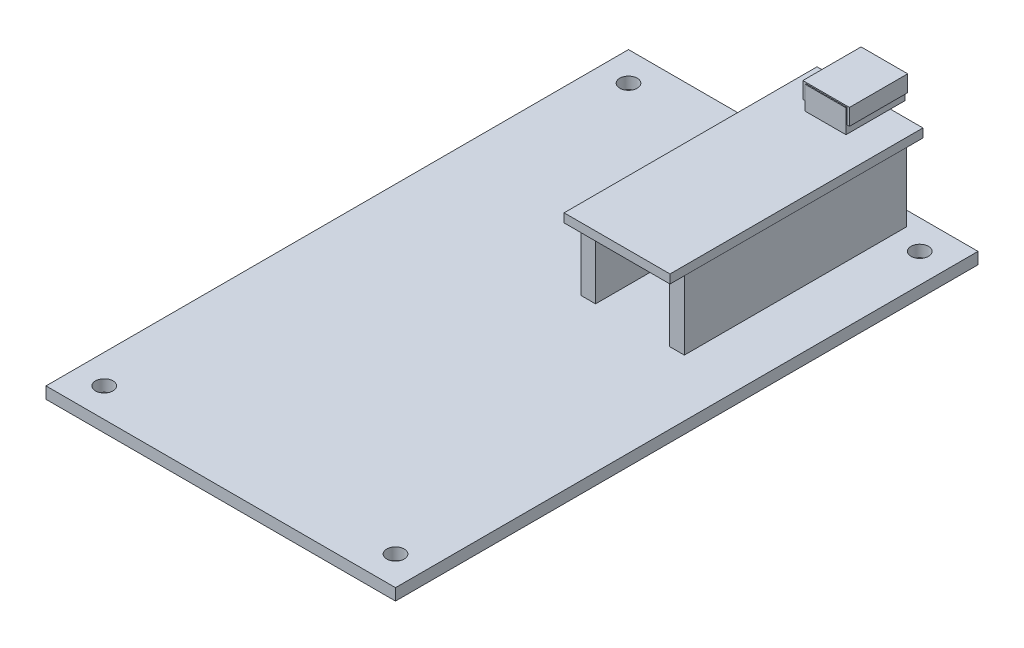
from build123d import *

# Parameters (mm, degrees)
CROQUIS1_W              = 60
CROQUIS1_H              = 100
CROQUIS1_R              = 1.5
SALIENTE_EXTRUIR1_DEPTH = 2
CROQUIS2_W              = 2.54
CROQUIS2_H              = 38.1
SALIENTE_EXTRUIR2_DEPTH = 12
CROQUIS3_W              = 18.18
CROQUIS3_H              = 43.42
SALIENTE_EXTRUIR3_DEPTH = 1.5
CROQUIS4_W              = 7
CROQUIS4_H              = 10.16
SALIENTE_EXTRUIR4_DEPTH = 4
SALIENTE_EXTRUIR5_DEPTH = 10


with BuildPart() as part:
    # Croquis1 → Saliente-Extruir1 (new body)
    with BuildSketch(Plane(origin=(0, 0, 0), x_dir=(1, 0, 0), z_dir=(0, 1, 0))):
        Rectangle(CROQUIS1_W, CROQUIS1_H)
        with Locations(Location((-25, 45, 0), (0, 0, 270))):
            Circle(CROQUIS1_R, mode=Mode.SUBTRACT)
        with Locations(Location((25, 45, 0), (0, 0, 90))):
            Circle(CROQUIS1_R, mode=Mode.SUBTRACT)
        with Locations(Location((25, -45, 0), (0, 0, 270))):
            Circle(CROQUIS1_R, mode=Mode.SUBTRACT)
        with Locations(Location((-25, -45, 0), (0, 0, 90))):
            Circle(CROQUIS1_R, mode=Mode.SUBTRACT)
    extrude(amount=SALIENTE_EXTRUIR1_DEPTH)

    # Croquis2 → Saliente-Extruir2 (add)
    with BuildSketch(Plane(origin=(0, 2, 0), x_dir=(1, 0, 0), z_dir=(0, 1, 0))):
        with Locations((3.711, 28.415)):
            Rectangle(CROQUIS2_W, CROQUIS2_H)
        with Locations((18.951, 28.415)):
            Rectangle(CROQUIS2_W, CROQUIS2_H)
    extrude(amount=SALIENTE_EXTRUIR2_DEPTH)


with BuildPart() as body_2:
    # Croquis3 → Saliente-Extruir3 (new body)
    with BuildSketch(Plane(origin=(0, 14, 0), x_dir=(1, 0, 0), z_dir=(0, 1, 0))):
        with Locations((11.331, 28.415)):
            Rectangle(CROQUIS3_W, CROQUIS3_H)
    extrude(amount=SALIENTE_EXTRUIR3_DEPTH)

    # Croquis4 → Saliente-Extruir4 (add)
    with BuildSketch(Plane(origin=(0, 15.5, 0), x_dir=(1, 0, 0), z_dir=(0, 1, 0))):
        with Locations((11.331, 47.585)):
            Rectangle(CROQUIS4_W, CROQUIS4_H)
    extrude(amount=SALIENTE_EXTRUIR4_DEPTH)

    # Croquis5 → Saliente-Extruir5 (add)
    with BuildSketch(Plane(origin=(0, 0, -52.665), x_dir=(-1, 0, 0), z_dir=(0, 0, -1))):
        Polygon((-15.26489693, 16.89), (-14.76489693, 16.89), (-14.76489693, 15.5), (-7.76489693, 15.5), (-7.76489693, 16.89), (-7.26489693, 16.89), (-7.26489693, 19.7), (-15.26489693, 19.7), align=None)
    extrude(amount=-SALIENTE_EXTRUIR5_DEPTH)


solid = Compound([part.part, body_2.part])
